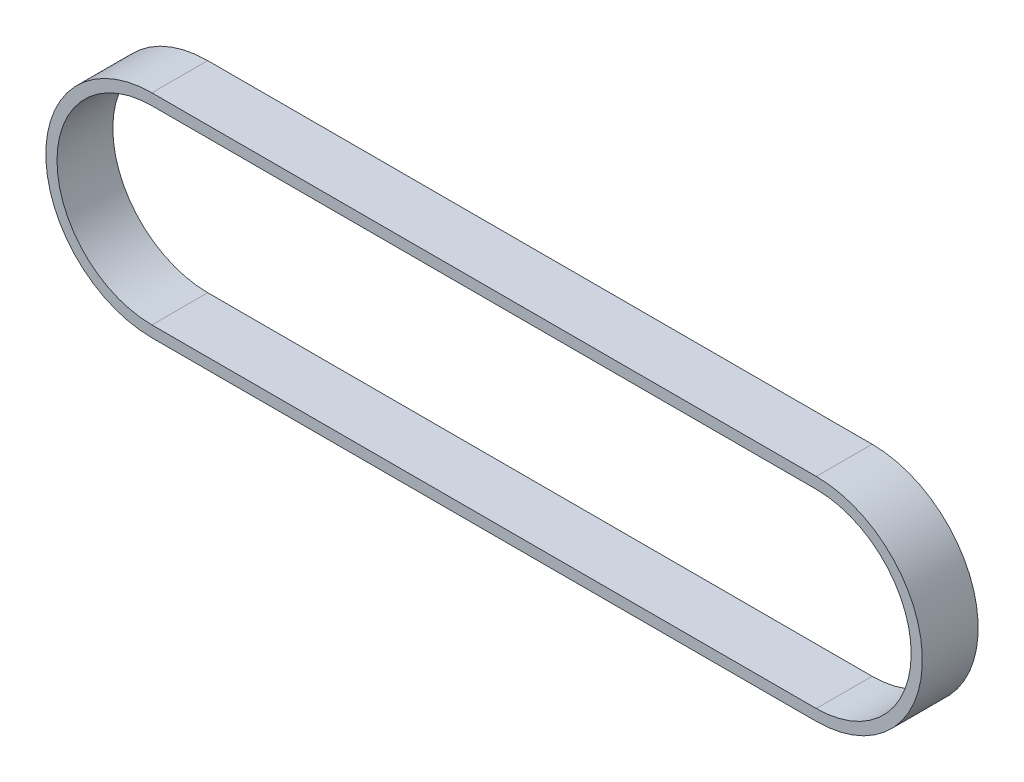
from build123d import *

# Parameters (mm, degrees)
EXTRUDE_1_DEPTH = 5


with BuildPart() as part:
    # 草图1 → 拉伸-薄壁1 (new, symmetric)
    with BuildSketch(Plane.XY):
        with BuildLine():
            Line((103.857819905, -19), (-15.142180095, -19))
            ThreePointArc((-15.142180095, -19), (-34.142180095, 0), (-15.142180095, 19))
            Line((-15.142180095, 19), (103.857819905, 19))
            ThreePointArc((103.857819905, 19), (122.857819905, 0), (103.857819905, -19))
        make_face()
        with BuildLine():
            Line((103.857819905, -17), (-15.142180095, -17))
            ThreePointArc((-15.142180095, -17), (-32.142180095, 0), (-15.142180095, 17))
            Line((-15.142180095, 17), (103.857819905, 17))
            ThreePointArc((103.857819905, 17), (120.857819905, 0), (103.857819905, -17))
        make_face(mode=Mode.SUBTRACT)
    extrude(amount=EXTRUDE_1_DEPTH, both=True)


solid = part.part
